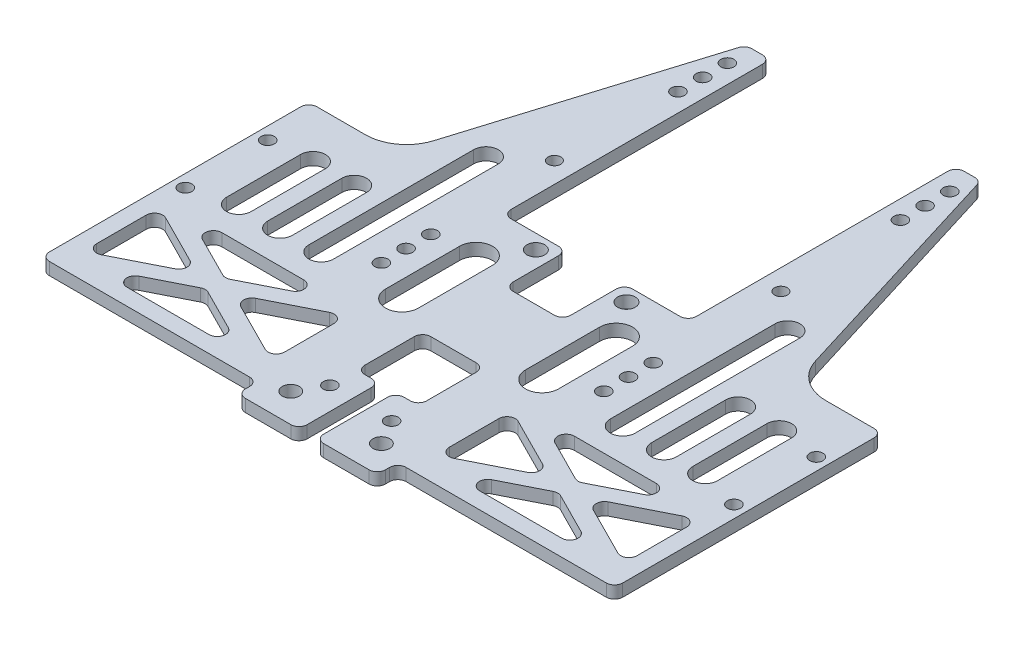
from build123d import *

# Parameters (mm, degrees)
SKETCH_1_W             = 139.2
SKETCH_1_H             = 65
EXTRUDE_1_DEPTH        = 3
SKETCH_2_R             = 1.6
CUT_EXTRUDE_1_DEPTH    = 3
SKETCH_5_W             = 6
SKETCH_5_H             = 65
EXTRUDE_2_DEPTH        = 3
SKETCH_6_R             = 2.15
SKETCH_6_W             = 14
SKETCH_6_H             = 15
CUT_EXTRUDE_2_DEPTH    = 3
SKETCH_7_R             = 1.6
CUT_EXTRUDE_3_DEPTH    = 10
PATTERN_LINEAR_1_COUNT = 3
PATTERN_LINEAR_1_PITCH = 6
FILLET_1_R             = 10
FILLET_2_R             = 2
SKETCH_8_R             = 1.6
SKETCH_8_W             = 15
SKETCH_8_H             = 16
CUT_EXTRUDE_4_DEPTH    = 10
SKETCH_9_W             = 4
SKETCH_9_H             = 14.5
SKETCH_9_W_2           = 45.6
SKETCH_9_H_2           = 23
CUT_EXTRUDE_5_DEPTH    = 10
EXTRUDE_1_2_DEPTH      = 3
FILLET_3_R             = 2
SKETCH_11_W            = 15
SKETCH_11_H            = 7
EXTRUDE_3_DEPTH        = 3
FILLET_4_R             = 2
SKETCH_12_R            = 2.05
CUT_EXTRUDE_6_DEPTH    = 3
SKETCH_13_R            = 1.55
CUT_EXTRUDE_7_DEPTH    = 10


with BuildPart() as part:
    # 草图1 → Extrude 1 (new body)
    with BuildSketch(Plane(origin=(0, 0, 0), x_dir=(1, 0, 0), z_dir=(0, 1, 0))):
        Rectangle(SKETCH_1_W, SKETCH_1_H)
    extrude(amount=EXTRUDE_1_DEPTH)

    # 草图2 → 切除-拉伸1 (cut)
    with BuildSketch(Plane(origin=(0, 3, 0), x_dir=(1, 0, 0), z_dir=(0, 1, 0))):
        with Locations(Location((-7.5, -24.5, 0), (0, 0, 270))):
            Circle(SKETCH_2_R)
        with Locations(Location((7.5, -24.5, 0), (0, 0, 270))):
            Circle(SKETCH_2_R)
    extrude(amount=-CUT_EXTRUDE_1_DEPTH, mode=Mode.SUBTRACT)

    # 草图5 → 凸台-拉伸2 (add)
    with BuildSketch(Plane.XZ):
        Polygon((-28.5, -97.5), (-28.5, -32.5), (-48.5, -32.5), align=None)
        with Locations((-25.5, -65)):
            Rectangle(SKETCH_5_W, SKETCH_5_H)
        with Locations((25.5, -65)):
            Rectangle(SKETCH_5_W, SKETCH_5_H)
        Polygon((48.5, -32.5), (28.5, -32.5), (28.5, -97.5), align=None)
    extrude(amount=-EXTRUDE_2_DEPTH)

    # 草图6 → 切除-拉伸2 (cut)
    with BuildSketch(Plane(origin=(0, 3, 0), x_dir=(1, 0, 0), z_dir=(0, 1, 0))):
        with Locations(Location((11, 29, 0), (0, 0, 270))):
            Circle(SKETCH_6_R)
        with Locations(Location((-11, 29, 0), (0, 0, 270))):
            Circle(SKETCH_6_R)
        with Locations((0, 25)):
            Rectangle(SKETCH_6_W, SKETCH_6_H)
    extrude(amount=-CUT_EXTRUDE_2_DEPTH, mode=Mode.SUBTRACT)

    # 草图7 → 切除-拉伸3 (cut)
    with BuildSketch(Plane(origin=(0, 3, 0), x_dir=(1, 0, 0), z_dir=(0, 1, 0))):
        with Locations(Location((27, 91.5, 0), (0, 0, 270))):
            Circle(SKETCH_7_R)
        with Locations(Location((-27, 91.5, 0), (0, 0, 270))):
            Circle(SKETCH_7_R)
        with Locations(Location((-27, 19.5, 0), (0, 0, 270))):
            Circle(SKETCH_7_R)
        with Locations(Location((27, 19.5, 0), (0, 0, 270))):
            Circle(SKETCH_7_R)
    cut_extrude_3 = extrude(amount=-CUT_EXTRUDE_3_DEPTH, mode=Mode.SUBTRACT)

    # 阵列(线性)1: 切除-拉伸3 ×3
    with Locations(*[(0, 0, i * PATTERN_LINEAR_1_PITCH) for i in range(1, PATTERN_LINEAR_1_COUNT)]):
        add(cut_extrude_3, mode=Mode.SUBTRACT)

    # 圆角1
    fillet_1_edges = [part.edges().sort_by_distance(p)[0] for p in [
        (-48.5, 1.5, -32.5),
        (48.5, 1.5, -32.5),
    ]]
    fillet(fillet_1_edges, radius=FILLET_1_R)

    # 圆角2
    fillet_2_edges = [part.edges().sort_by_distance(p)[0] for p in [
        (-28.5, 1.5, -97.5),
        (-22.5, 1.5, -32.5),
        (-22.5, 1.5, -97.5),
        (28.5, 1.5, -97.5),
        (22.5, 1.5, -97.5),
        (22.5, 1.5, -32.5),
        (-7, 1.5, -17.5),
        (-7, 1.5, -32.5),
        (7, 1.5, -32.5),
        (7, 1.5, -17.5),
        (69.6, 1.5, 32.5),
        (-69.6, 1.5, 32.5),
        (-69.6, 1.5, -32.5),
        (69.6, 1.5, -32.5),
    ]]
    fillet(fillet_2_edges, radius=FILLET_2_R)

    # 草图8 → 切除-拉伸4 (cut)
    with BuildSketch(Plane(origin=(0, 3, 0), x_dir=(1, 0, 0), z_dir=(0, 1, 0))):
        with Locations(Location((66.6, 19.5, 0), (0, 0, 270))):
            Circle(SKETCH_8_R)
        with Locations(Location((66.6, -0.5, 0), (0, 0, 270))):
            Circle(SKETCH_8_R)
        with Locations(Location((-66.6, -0.5, 0), (0, 0, 270))):
            Circle(SKETCH_8_R)
        with Locations(Location((-66.6, 19.5, 0), (0, 0, 270))):
            Circle(SKETCH_8_R)
        with Locations((0, -10)):
            Rectangle(SKETCH_8_W, SKETCH_8_H)
    extrude(amount=-CUT_EXTRUDE_4_DEPTH, mode=Mode.SUBTRACT)

    # 草图9 → 切除-拉伸5 (cut)
    with BuildSketch(Plane(origin=(0, 3, 0), x_dir=(1, 0, 0), z_dir=(0, 1, 0))):
        with Locations((0, -25.25)):
            Rectangle(SKETCH_9_W, SKETCH_9_H)
        with BuildLine():
            Line((-53.6, 20.5), (-53.6, 2.5))
            ThreePointArc((-53.6, 2.5), (-56.6, -0.5), (-59.6, 2.5))
            Line((-59.6, 2.5), (-59.6, 20.5))
            ThreePointArc((-59.6, 20.5), (-56.6, 23.5), (-53.6, 20.5))
        make_face()
        with Locations((-42.8, -17)):
            Rectangle(SKETCH_9_W_2, SKETCH_9_H_2)
        with BuildLine():
            Line((53.6, 20.5), (53.6, 2.5))
            ThreePointArc((53.6, 2.5), (56.6, -0.5), (59.6, 2.5))
            Line((59.6, 2.5), (59.6, 20.5))
            ThreePointArc((59.6, 20.5), (56.6, 23.5), (53.6, 20.5))
        make_face()
        with Locations((42.8, -17)):
            Rectangle(SKETCH_9_W_2, SKETCH_9_H_2)
        with BuildLine():
            Line((-43.6, 20.5), (-43.6, 2.5))
            ThreePointArc((-43.6, 2.5), (-46.6, -0.5), (-49.6, 2.5))
            Line((-49.6, 2.5), (-49.6, 20.5))
            ThreePointArc((-49.6, 20.5), (-46.6, 23.5), (-43.6, 20.5))
        make_face()
        with BuildLine():
            Line((-33.6, 42.5), (-33.6, 2.5))
            ThreePointArc((-33.6, 2.5), (-36.6, -0.5), (-39.6, 2.5))
            Line((-39.6, 2.5), (-39.6, 42.5))
            ThreePointArc((-39.6, 42.5), (-36.6, 45.5), (-33.6, 42.5))
        make_face()
        with BuildLine():
            Line((-13, 20.5), (-13, 2.5))
            ThreePointArc((-13, 2.5), (-17, -1.5), (-21, 2.5))
            Line((-21, 2.5), (-21, 20.5))
            ThreePointArc((-21, 20.5), (-17, 24.5), (-13, 20.5))
        make_face()
        with BuildLine():
            Line((13, 20.5), (13, 2.5))
            ThreePointArc((13, 2.5), (17, -1.5), (21, 2.5))
            Line((21, 2.5), (21, 20.5))
            ThreePointArc((21, 20.5), (17, 24.5), (13, 20.5))
        make_face()
        with BuildLine():
            Line((33.6, 42.5), (33.6, 2.5))
            ThreePointArc((33.6, 2.5), (36.6, -0.5), (39.6, 2.5))
            Line((39.6, 2.5), (39.6, 42.5))
            ThreePointArc((39.6, 42.5), (36.6, 45.5), (33.6, 42.5))
        make_face()
        with BuildLine():
            Line((43.6, 20.5), (43.6, 2.5))
            ThreePointArc((43.6, 2.5), (46.6, -0.5), (49.6, 2.5))
            Line((49.6, 2.5), (49.6, 20.5))
            ThreePointArc((49.6, 20.5), (46.6, 23.5), (43.6, 20.5))
        make_face()
    extrude(amount=-CUT_EXTRUDE_5_DEPTH, mode=Mode.SUBTRACT)

    # 草图10 → Extrude 1 2 (add)
    with BuildSketch(Plane(origin=(0, 3, 0), x_dir=(1, 0, 0), z_dir=(0, 1, 0))):
        Polygon((-20.900687356, -3.714289417), (-66.500687356, -26.714289417), (-64.699312644, -30.285710583), (-19.099312644, -7.285710583), align=None)
        Polygon((-66.500687356, -7.285710583), (-20.900687356, -30.285710583), (-19.099312644, -26.714289417), (-64.699312644, -3.714289417), align=None)
        Polygon((19.099312644, -7.285710583), (64.699312644, -30.285710583), (66.500687356, -26.714289417), (20.900687356, -3.714289417), align=None)
        Polygon((20.900687356, -30.285710583), (66.500687356, -7.285710583), (64.699312644, -3.714289417), (19.099312644, -26.714289417), align=None)
    extrude(amount=-EXTRUDE_1_2_DEPTH)

    # 圆角3
    fillet_3_edges = [part.edges().sort_by_distance(p)[0] for p in [
        (-7.5, 1.5, 18),
        (-7.5, 1.5, 2),
        (7.5, 1.5, 2),
        (7.5, 1.5, 18),
        (2, 1.5, 18),
        (-2, 1.5, 18),
        (2, 1.5, 32.5),
        (-2, 1.5, 32.5),
        (-24.441052686, 1.5, 28.5),
        (-61.158947314, 1.5, 28.5),
        (-20, 1.5, 26.259995356),
        (-20, 1.5, 7.740004644),
        (-61.158947314, 1.5, 5.5),
        (-24.441052686, 1.5, 5.5),
        (-65.6, 1.5, 7.740004644),
        (-65.6, 1.5, 26.259995356),
        (-47.241052686, 1.5, 17),
        (-42.8, 1.5, 14.759995356),
        (-38.358947314, 1.5, 17),
        (-42.8, 1.5, 19.240004644),
        (61.158947314, 1.5, 5.5),
        (24.441052686, 1.5, 5.5),
        (20, 1.5, 26.259995356),
        (20, 1.5, 7.740004644),
        (24.441052686, 1.5, 28.5),
        (61.158947314, 1.5, 28.5),
        (65.6, 1.5, 7.740004644),
        (65.6, 1.5, 26.259995356),
        (47.241052686, 1.5, 17),
        (42.8, 1.5, 19.240004644),
        (38.358947314, 1.5, 17),
        (42.8, 1.5, 14.759995356),
    ]]
    fillet(fillet_3_edges, radius=FILLET_3_R)

    # 草图11 → 凸台-拉伸3 (add)
    with BuildSketch(Plane(origin=(0, 3, 0), x_dir=(1, 0, 0), z_dir=(0, 1, 0))):
        with Locations((9.5, -34)):
            Rectangle(SKETCH_11_W, SKETCH_11_H)
        with Locations((-9.5, -34)):
            Rectangle(SKETCH_11_W, SKETCH_11_H)
    extrude(amount=-EXTRUDE_3_DEPTH)

    # 圆角4
    fillet_4_edges = [part.edges().sort_by_distance(p)[0] for p in [
        (-17, 1.5, 37.5),
        (-2, 1.5, 37.5),
        (-17, 1.5, 32.5),
        (2, 1.5, 37.5),
        (17, 1.5, 32.5),
        (17, 1.5, 37.5),
    ]]
    fillet(fillet_4_edges, radius=FILLET_4_R)

    # 草图12 → 切除-拉伸6 (cut)
    with BuildSketch(Plane(origin=(0, 3, 0), x_dir=(1, 0, 0), z_dir=(0, 1, 0))):
        with Locations(Location((-11, -30.5, 0), (0, 0, 270))):
            Circle(SKETCH_12_R)
        with Locations(Location((11, -30.5, 0), (0, 0, 270))):
            Circle(SKETCH_12_R)
    extrude(amount=-CUT_EXTRUDE_6_DEPTH, mode=Mode.SUBTRACT)

    # 草图13 → 切除-拉伸7 (cut)
    with BuildSketch(Plane(origin=(0, 3, 0), x_dir=(1, 0, 0), z_dir=(0, 1, 0))):
        with Locations(Location((27.5, 50, 0), (0, 0, 270))):
            Circle(SKETCH_13_R)
        with Locations(Location((-27.5, 50, 0), (0, 0, 270))):
            Circle(SKETCH_13_R)
    extrude(amount=-CUT_EXTRUDE_7_DEPTH, mode=Mode.SUBTRACT)


solid = part.part
